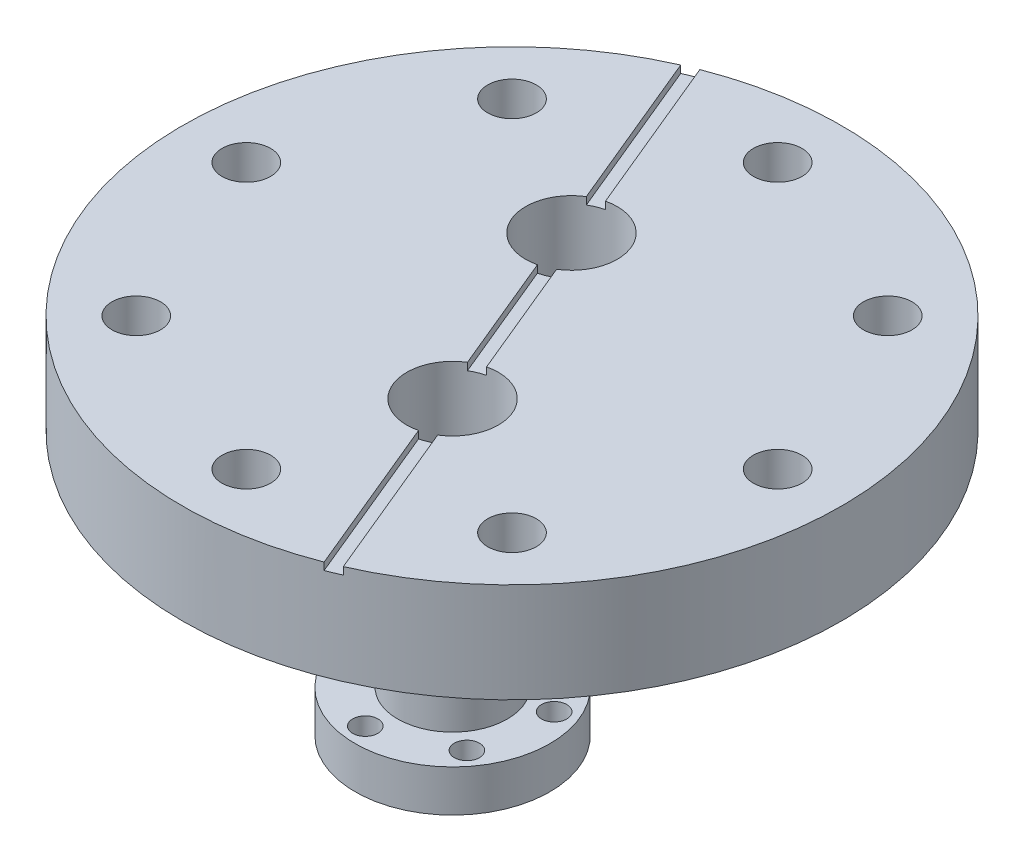
from build123d import *

# Parameters (mm, degrees)
SKETCH1_R         = 57.15
EXTRUDE1_DEPTH    = 17.272
SKETCH3_R         = 4.2164
EXTRUDE2_DEPTH    = 83.647244261
CIRPATTERN1_COUNT = 8
SKETCH5_R         = 9.4996
SKETCH5_R_2       = 7.9375
EXTRUDE3_DEPTH    = 33.3375
EXTRUDE4_START    = -7.239
SKETCH6_R         = 16.891
SKETCH6_R_2       = 7.9375
EXTRUDE4_DEPTH    = 7.239
EXTRUDE5_REACH    = 97.36
SKETCH7_R         = 2.1844
CIRPATTERN2_COUNT = 6
SKETCH8_R         = 7.9375
EXTRUDE6_DEPTH    = 96.360193426
SKETCH9_R         = 16.891
SKETCH9_R_2       = 7.9375
EXTRUDE7_DEPTH    = 7.239
SKETCH11_R        = 7.9375
EXTRUDE8_DEPTH    = 85.931600139
SKETCH12_R        = 2.1844
EXTRUDE9_DEPTH    = 7.239
CIRPATTERN3_COUNT = 6
EXTRUDE10_DEPTH   = 1.27


with BuildPart() as part:
    # Sketch1 → Extrude1 (new body)
    with BuildSketch(Plane(origin=(0, 0, 0), x_dir=(1, 0, 0), z_dir=(0, 1, 0))):
        with Locations(Location((0, 0, 0), (0, 0, 270))):
            Circle(SKETCH1_R)
    extrude(amount=EXTRUDE1_DEPTH)

    # Sketch3 → Extrude2 (cut, through all)
    with BuildSketch(Plane.XZ):
        with Locations(Location((0, 46.0756, 0), (0, 0, 270))):
            Circle(SKETCH3_R)
    extrude2 = extrude(amount=-EXTRUDE2_DEPTH, mode=Mode.SUBTRACT)

    # CirPattern1: Extrude2 ×8 about axis
    cirpattern1_axis = Axis((0, 0, 0), (0, 1, 0))
    for i in range(1, CIRPATTERN1_COUNT):
        add(extrude2.rotate(cirpattern1_axis, i * 360 / CIRPATTERN1_COUNT), mode=Mode.SUBTRACT)

    # Sketch5 → Extrude3 (add)
    with BuildSketch(Plane.XZ):
        with Locations(Location((7.290119387, 17.599905094, 0), (0, 0, 90))):
            Circle(SKETCH5_R)
        with Locations(Location((7.290119387, 17.599905094, 0), (0, 0, 270))):
            Circle(SKETCH5_R_2, mode=Mode.SUBTRACT)
    extrude(amount=EXTRUDE3_DEPTH)

    # Sketch6 → Extrude4 (add)
    with BuildSketch(Plane.XZ.offset(33.3375).offset(EXTRUDE4_START)):
        with Locations(Location((7.290119387, 17.599905094, 0), (0, 0, 270))):
            Circle(SKETCH6_R)
        with Locations(Location((7.290119387, 17.599905094, 0), (0, 0, 270))):
            Circle(SKETCH6_R_2, mode=Mode.SUBTRACT)
    extrude(amount=EXTRUDE4_DEPTH)

    # Sketch7 → Extrude5 (cut, up to next)
    with BuildSketch(Plane.XZ.offset(33.3375), mode=Mode.PRIVATE) as extrude5_sk1:
        with Locations(Location((-3.410154455, 9.389296197, 0), (0, 0, 270))):
            Circle(SKETCH7_R)
    extrude5_tool1 = extrude(extrude5_sk1.sketch, amount=-EXTRUDE5_REACH, mode=Mode.PRIVATE) & part.part
    extrude5 = extrude5_tool1.solids().sort_by_distance((-3.410154, -33.3375, 9.389296))[0]
    add(extrude5, mode=Mode.SUBTRACT)

    # CirPattern2: Extrude5 ×6 about axis
    cirpattern2_axis = Axis((7.290119387, 0, 17.599905094), (0, 1, 0))
    for i in range(1, CIRPATTERN2_COUNT):
        add(extrude5.rotate(cirpattern2_axis, i * 360 / CIRPATTERN2_COUNT), mode=Mode.SUBTRACT)

    # Sketch8 → Extrude6 (cut, through all)
    with BuildSketch(Plane.XZ.offset(33.3375)):
        with Locations(Location((7.290119387, 17.599905094, 0), (0, 0, 270))):
            Circle(SKETCH8_R)
    extrude(amount=-EXTRUDE6_DEPTH, mode=Mode.SUBTRACT)

    # Sketch9 → Extrude7 (add)
    with BuildSketch(Plane.XZ):
        with Locations(Location((-7.290119387, -17.599905094, 0), (0, 0, 90))):
            Circle(SKETCH9_R)
        with Locations(Location((-7.290119387, -17.599905094, 0), (0, 0, 270))):
            Circle(SKETCH9_R_2, mode=Mode.SUBTRACT)
    extrude(amount=EXTRUDE7_DEPTH)

    # Sketch11 → Extrude8 (cut, through all)
    with BuildSketch(Plane.XZ.offset(7.239)):
        with Locations(Location((-7.290119387, -17.599905094, 0), (0, 0, 270))):
            Circle(SKETCH11_R)
    extrude(amount=-EXTRUDE8_DEPTH, mode=Mode.SUBTRACT)

    # Sketch12 → Extrude9 (cut)
    with BuildSketch(Plane.XZ.offset(7.239)):
        with Locations(Location((3.410154455, -9.389296197, 0), (0, 0, 270))):
            Circle(SKETCH12_R)
    extrude9 = extrude(amount=-EXTRUDE9_DEPTH, mode=Mode.SUBTRACT)

    # CirPattern3: Extrude9 ×6 about axis
    cirpattern3_axis = Axis((-7.290119387, 0, -17.599905094), (0, 1, 0))
    for i in range(1, CIRPATTERN3_COUNT):
        add(extrude9.rotate(cirpattern3_axis, i * 360 / CIRPATTERN3_COUNT), mode=Mode.SUBTRACT)

    # Sketch13 → Extrude10 (cut)
    with BuildSketch(Plane(origin=(0, 17.272, 0), x_dir=(1, 0, 0), z_dir=(0, 1, 0))):
        Polygon((-24.155973891, 61.636349712), (-26.502627904, 60.664333794), (25.660622812, -65.268893542), (28.007276825, -64.296877624), align=None)
    extrude(amount=-EXTRUDE10_DEPTH, mode=Mode.SUBTRACT)


solid = part.part
